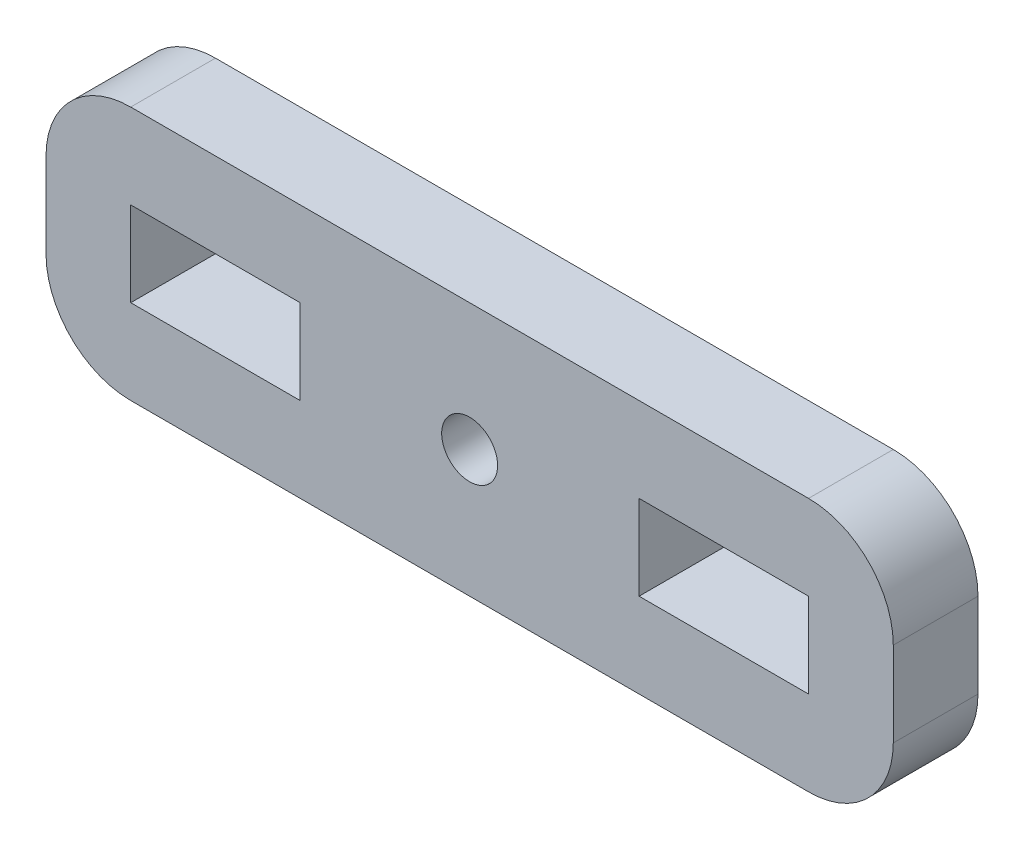
from build123d import *

# Parameters (mm, degrees)
SKETCH1_W           = 63.5
SKETCH1_H           = 19.05
BOSS_EXTRUDE1_DEPTH = 6.35
SKETCH2_R           = 2.0955
SKETCH2_W           = 12.7
SKETCH2_H           = 6.35
CUT_EXTRUDE1_DEPTH  = 6.35
FILLET1_R           = 6.35


with BuildPart() as part:
    # Sketch1 → Boss-Extrude1 (new body)
    with BuildSketch(Plane.XY):
        Rectangle(SKETCH1_W, SKETCH1_H)
    extrude(amount=BOSS_EXTRUDE1_DEPTH)

    # Sketch2 → Cut-Extrude1 (cut)
    with BuildSketch(Plane.XY.offset(6.35)):
        Circle(SKETCH2_R)
        with Locations((-19.05, 0)):
            Rectangle(SKETCH2_W, SKETCH2_H)
        with Locations((19.05, 0)):
            Rectangle(SKETCH2_W, SKETCH2_H)
    extrude(amount=-CUT_EXTRUDE1_DEPTH, mode=Mode.SUBTRACT)

    # Fillet1
    fillet1_edges = [part.edges().sort_by_distance(p)[0] for p in [
        (31.75, -9.525, 3.175),
        (-31.75, -9.525, 3.175),
        (-31.75, 9.525, 3.175),
        (31.75, 9.525, 3.175),
    ]]
    fillet(fillet1_edges, radius=FILLET1_R)


solid = part.part
